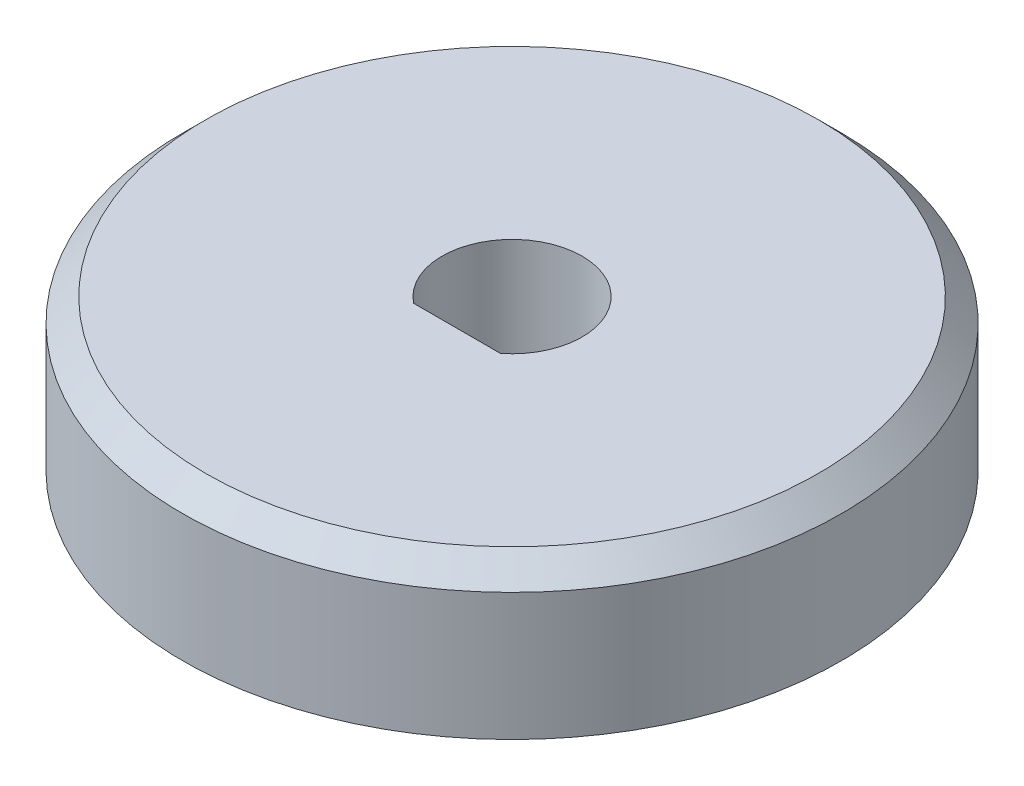
from build123d import *

# Parameters (mm, degrees)
SKETCH1_R           = 14.225
BOSS_EXTRUDE1_DEPTH = 6.5
CHAMFER1_SIZE       = 1


with BuildPart() as part:
    # Sketch1 → Boss-Extrude1 (new body)
    with BuildSketch(Plane(origin=(0, 0, 0), x_dir=(1, 0, 0), z_dir=(0, 1, 0))):
        with Locations(Location((0, 0, 0), (0, 0, 90))):
            Circle(SKETCH1_R)
        with BuildLine():
            Line((-1.8734994, -2.375), (1.8734994, -2.375))
            ThreePointArc((1.8734994, -2.375), (0, 3.025), (-1.8734994, -2.375))
        make_face(mode=Mode.SUBTRACT)
    extrude(amount=BOSS_EXTRUDE1_DEPTH)

    # Chamfer1
    chamfer1_edges = [part.edges().sort_by_distance(p)[0] for p in [
        (0, 6.5, 14.225),
    ]]
    chamfer(chamfer1_edges, length=CHAMFER1_SIZE)


solid = part.part
